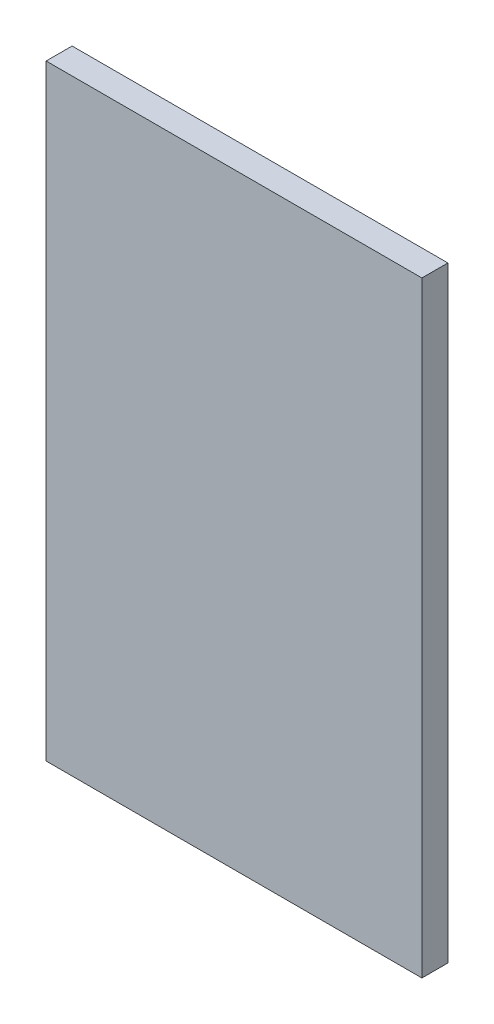
from build123d import *

# Parameters (mm, degrees)
SKETCH_1_W      = 43.4
SKETCH_1_H      = 70.02
EXTRUDE_1_DEPTH = 3


with BuildPart() as part:
    # ｽｹｯﾁ1 → ﾎﾞｽ - 押し出し1 (new body)
    with BuildSketch(Plane.XY):
        Rectangle(SKETCH_1_W, SKETCH_1_H)
    extrude(amount=EXTRUDE_1_DEPTH)


solid = part.part
